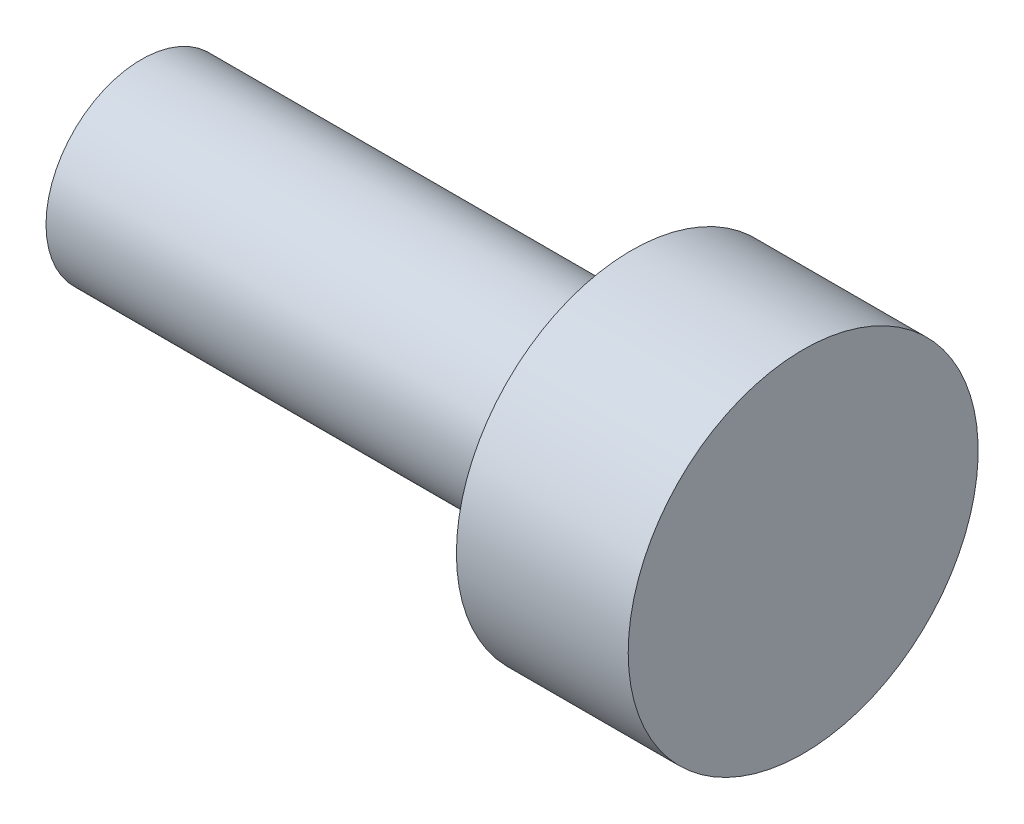
from build123d import *


with BuildPart() as part:
    # Axial profile (mm) → Full revolution (revolve)
    with BuildSketch(Plane.XY, mode=Mode.PRIVATE) as full_revolution_sk:
        Polygon((132, 0), (142.4, 0), (142.4, 2.75), (139.7, 2.75), (139.7, 1.5), (132, 1.5), align=None)
    revolve(full_revolution_sk.sketch.rotate(Axis((-110, 0, 0), (1, 0, 0)), 90), axis=Axis((-110, 0, 0), (1, 0, 0)))


solid = part.part
